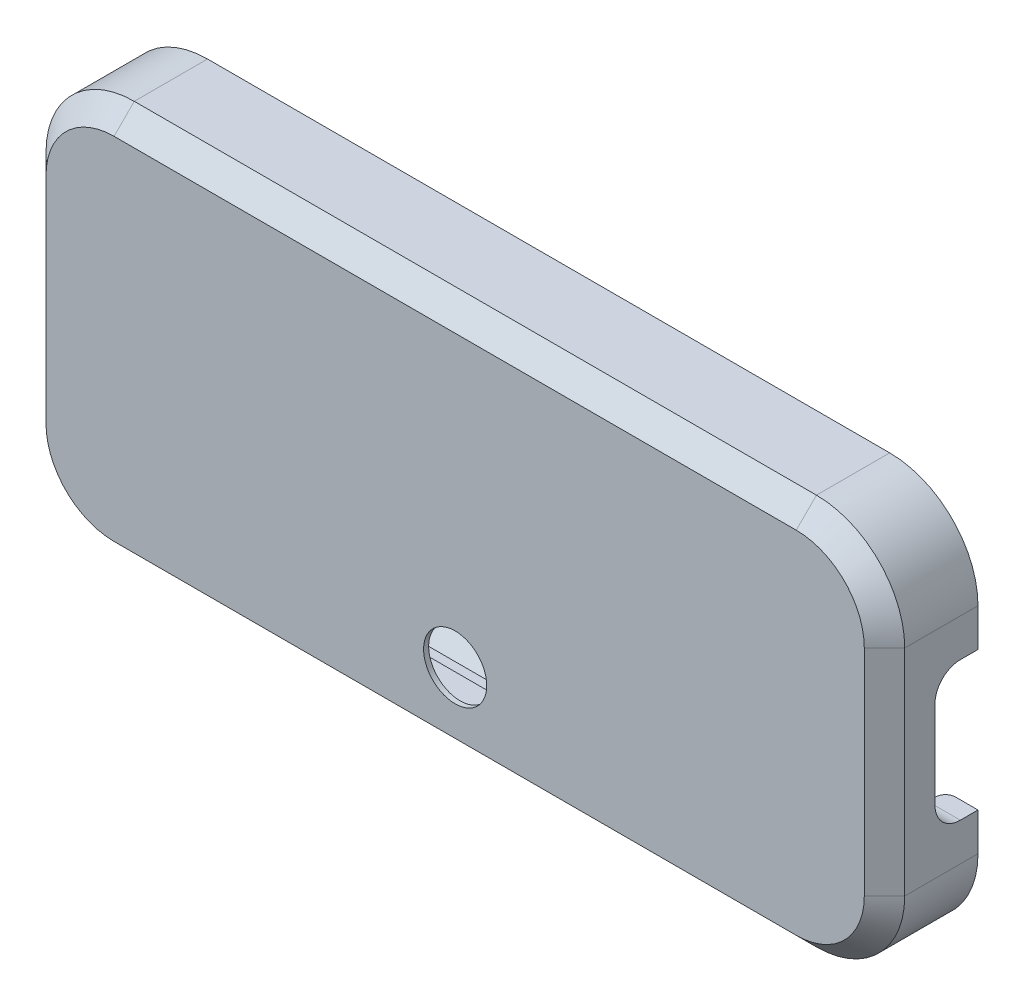
from build123d import *

# Parameters (mm, degrees)
SKIZZE1_W                         = 7.626009652
SKIZZE1_H                         = 10.039014478
AUFSATZ_LINEAR_AUSTRAGEN1_DEPTH   = 1.5
AUFSATZ_LINEAR_AUSTRAGEN1_2_DEPTH = 1.5
AUFSATZ_LINEAR_AUSTRAGEN1_3_DEPTH = 1.5
AUFSATZ_LINEAR_AUSTRAGEN1_4_DEPTH = 1.5
AUFSATZ_LINEAR_AUSTRAGEN1_5_DEPTH = 1.5
SKIZZE2_R                         = 2.5
AUFSATZ_LINEAR_AUSTRAGEN2_DEPTH   = 0.4
AUFSATZ_LINEAR_AUSTRAGEN3_DEPTH   = 2.2
AUFSATZ_LINEAR_AUSTRAGEN14_DEPTH  = 7
SKIZZE14_R                        = 2.5
SKIZZE14_W                        = 7.626009652
SKIZZE14_H                        = 10.039014478
AUFSATZ_LINEAR_AUSTRAGEN15_DEPTH  = 0.9
VERRUNDUNG1_R                     = 0.8
SCHNITT_LINEAR_AUSTRAGEN1_DEPTH   = 5
SCHNITT_LINEAR_AUSTRAGEN2_DEPTH   = 0.9
FASE1_SIZE                        = 1.6


with BuildPart() as part:
    # Skizze1 → Aufsatz-Linear austragen1 (new body)
    with BuildSketch(Plane.XY.offset(2.3000508)):
        with Locations((-8.282016764, -0.163000133)):
            Rectangle(SKIZZE1_W, SKIZZE1_H)
        Polygon((-11.69502159, 4.456507106), (-5.069011938, 4.456507106), (-5.069011938, -4.582507372), (-9.09502159, -4.582507372), (-11.69502159, -4.124057223), (-11.69502159, 0.203832093), (-9.09502159, 0.900499994), (-7.35501651, 0.900499994), (-7.35501651, -0.899500006), (-9.89502159, -0.899500006), (-9.89502159, -2.782507372), (-6.869011938, -2.782507372), (-6.869011938, 2.656507106), (-11.69502159, 2.656507106), align=None, mode=Mode.SUBTRACT)
    extrude(amount=AUFSATZ_LINEAR_AUSTRAGEN1_DEPTH)



with BuildPart() as body_2:
    # Skizze1 → Aufsatz-Linear austragen1 2 (new body)
    with BuildSketch(Plane.XY.offset(2.3000508)):
        Polygon((-15.915075673, 4.956507106), (-28.451054102, 4.956507106), (-28.451054102, -5.082507372), (-25.651054102, -5.082507372), (-25.651054102, 2.156507106), (-22.99004318, 2.156507106), (-22.99004318, -5.082507372), (-20.19004318, -5.082507372), (-20.19004318, 2.156507106), (-17.91003302, 2.156507106), (-17.91003302, -5.082507372), (-15.11003302, -5.082507372), (-15.11003302, 2.744670596), align=None)
        Polygon((-27.951054102, -4.582507372), (-26.151054102, -4.582507372), (-26.151054102, 2.656507106), (-22.49004318, 2.656507106), (-22.49004318, -4.582507372), (-20.69004318, -4.582507372), (-20.69004318, 2.656507106), (-17.41003302, 2.656507106), (-17.41003302, -4.582507372), (-15.61003302, -4.582507372), (-15.61003302, 2.656507106), (-16.265179442, 4.456507106), (-27.951054102, 4.456507106), align=None, mode=Mode.SUBTRACT)
    extrude(amount=AUFSATZ_LINEAR_AUSTRAGEN1_2_DEPTH)


with BuildPart() as body_3:
    # Skizze1 → Aufsatz-Linear austragen1 3 (new body)
    with BuildSketch(Plane.XY.offset(2.3000508)):
        Polygon((5.972009144, 4.956507106), (3.559004318, 4.956507106), (3.559004318, 8.89351498), (0.759004318, 8.89351498), (0.759004318, 4.956507106), (-1.654000508, 4.956507106), (-1.654000508, 2.156507106), (0.759004318, 2.156507106), (0.759004318, -5.082507372), (5.972009144, -5.082507372), (5.972009144, -2.282507372), (3.559004318, -2.282507372), (3.559004318, 2.156507106), (5.972009144, 2.156507106), align=None)
        Polygon((1.259004318, 8.39351498), (1.259004318, 4.456507106), (-1.154000508, 4.456507106), (-1.154000508, 2.656507106), (1.259004318, 2.656507106), (1.259004318, -4.582507372), (5.472009144, -4.582507372), (5.472009144, -2.782507372), (3.059004318, -2.782507372), (3.059004318, 2.656507106), (5.472009144, 2.656507106), (5.472009144, 4.456507106), (3.059004318, 4.456507106), (3.059004318, 8.39351498), align=None, mode=Mode.SUBTRACT)
    extrude(amount=AUFSATZ_LINEAR_AUSTRAGEN1_3_DEPTH)


with BuildPart() as body_4:
    # Skizze1 → Aufsatz-Linear austragen1 4 (new body)
    with BuildSketch(Plane.XY.offset(2.3000508)):
        Polygon((10.972977453, 4.956507106), (16.513030226, 4.956507106), (16.513030226, 2.156507106), (12.264129895, 2.156507106), (11.687020574, 1.579397784), (11.687020574, -1.705398051), (12.264129895, -2.282507372), (16.513030226, -2.282507372), (16.513030226, -5.082507372), (10.972977453, -5.082507372), (8.887020574, -3.332181725), (8.887020574, 3.206181458), align=None)
        Polygon((16.013030226, 2.656507106), (12.057023114, 2.656507106), (11.187020574, 1.786504566), (11.187020574, -1.912504832), (12.057023114, -2.782507372), (16.013030226, -2.782507372), (16.013030226, -4.582507372), (11.15496257, -4.582507372), (9.387020574, -3.099027896), (9.387020574, 2.973027629), (11.15496257, 4.456507106), (16.013030226, 4.456507106), align=None, mode=Mode.SUBTRACT)
    extrude(amount=AUFSATZ_LINEAR_AUSTRAGEN1_4_DEPTH)


with BuildPart() as body_5:
    # Skizze1 → Aufsatz-Linear austragen1 5 (new body)
    with BuildSketch(Plane.XY.offset(2.3000508)):
        Polygon((27.321990188, 4.856507106), (22.128041656, 4.856507106), (22.128041656, 8.666514726), (19.528041656, 8.666514726), (19.528041656, -4.982507372), (22.128041656, -4.982507372), (22.128041656, 2.256507106), (25.497053594, 2.256507106), (25.497053594, -4.982507372), (28.097053594, -4.982507372), (28.097053594, 2.727037898), align=None)
        Polygon((19.928041656, 8.266514726), (19.928041656, -4.582507372), (21.728041656, -4.582507372), (21.728041656, 2.656507106), (25.897053594, 2.656507106), (25.897053594, -4.582507372), (27.697053594, -4.582507372), (27.697053594, 2.656507106), (27.041907172, 4.456507106), (21.728041656, 4.456507106), (21.728041656, 8.266514726), align=None, mode=Mode.SUBTRACT)
    extrude(amount=AUFSATZ_LINEAR_AUSTRAGEN1_5_DEPTH)


with BuildPart() as part_1:
    add(part.part)

    add(body_2.part)  # Aufsatz-Linear austragen2 merges body 2

    add(body_3.part)  # Aufsatz-Linear austragen2 merges body 3

    add(body_4.part)  # Aufsatz-Linear austragen2 merges body 4

    add(body_5.part)  # Aufsatz-Linear austragen2 merges body 5
    # Skizze2 → Aufsatz-Linear austragen2 (add)
    with BuildSketch(Plane.XY.offset(3.8000508)):
        with BuildLine():
            Line((-27.00005334, 15.487325375), (27.00005588, 15.487325375))
            ThreePointArc((27.00005588, 15.487325375), (31.940828463, 13.440790362), (33.987363475, 8.50001778))
            Line((33.987363475, 8.50001778), (33.987363475, -8.50001778))
            ThreePointArc((33.987363475, -8.50001778), (31.940828463, -13.440790362), (27.00005588, -15.487325375))
            Line((27.00005588, -15.487325375), (-27.00005334, -15.487325375))
            ThreePointArc((-27.00005334, -15.487325375), (-31.940825922, -13.440790362), (-33.987360935, -8.50001778))
            Line((-33.987360935, -8.50001778), (-33.987360935, 8.50001778))
            ThreePointArc((-33.987360935, 8.50001778), (-31.940825922, 13.440790362), (-27.00005334, 15.487325375))
        make_face()
        with Locations((0, -9.017018034)):
            Circle(SKIZZE2_R, mode=Mode.SUBTRACT)
    extrude(amount=AUFSATZ_LINEAR_AUSTRAGEN2_DEPTH)

    # Skizze3 → Aufsatz-Linear austragen3 (add)
    with BuildSketch(Plane(origin=(0, 0, 3.8000508), x_dir=(-1, 0, 0), z_dir=(0, 0, -1))):
        with BuildLine():
            Line((-27.225, -12.725), (27.225, -12.725))
            ThreePointArc((27.225, -12.725), (30.053427125, -11.553427125), (31.225, -8.725))
            Line((31.225, -8.725), (31.225, 8.725))
            ThreePointArc((31.225, 8.725), (30.053427125, 11.553427125), (27.225, 12.725))
            Line((27.225, 12.725), (-27.225, 12.725))
            ThreePointArc((-27.225, 12.725), (-30.053427125, 11.553427125), (-31.225, 8.725))
            Line((-31.225, 8.725), (-31.225, -8.725))
            ThreePointArc((-31.225, -8.725), (-30.053427125, -11.553427125), (-27.225, -12.725))
        make_face()
        with BuildLine():
            Line((-27.225, 11.925), (27.225, 11.925))
            ThreePointArc((27.225, 11.925), (29.4877417, 10.9877417), (30.425, 8.725))
            Line((30.425, 8.725), (30.425, -8.725))
            ThreePointArc((30.425, -8.725), (29.4877417, -10.9877417), (27.225, -11.925))
            Line((27.225, -11.925), (-27.225, -11.925))
            ThreePointArc((-27.225, -11.925), (-29.4877417, -10.9877417), (-30.425, -8.725))
            Line((-30.425, -8.725), (-30.425, 8.725))
            ThreePointArc((-30.425, 8.725), (-29.4877417, 10.9877417), (-27.225, 11.925))
        make_face(mode=Mode.SUBTRACT)
    extrude(amount=AUFSATZ_LINEAR_AUSTRAGEN3_DEPTH)

    # Skizze10 → Aufsatz-Linear austragen14 (add)
    with BuildSketch(Plane(origin=(0, 0, 3.8000508), x_dir=(-1, 0, 0), z_dir=(0, 0, -1))):
        with BuildLine():
            Line((27.00005334, 15.487325375), (-27.00005588, 15.487325375))
            ThreePointArc((-27.00005588, 15.487325375), (-31.940828463, 13.440790362), (-33.987363475, 8.50001778))
            Line((-33.987363475, 8.50001778), (-33.987363475, -8.50001778))
            ThreePointArc((-33.987363475, -8.50001778), (-31.940828463, -13.440790362), (-27.00005588, -15.487325375))
            Line((-27.00005588, -15.487325375), (27.00005334, -15.487325375))
            ThreePointArc((27.00005334, -15.487325375), (31.940825922, -13.440790362), (33.987360935, -8.50001778))
            Line((33.987360935, -8.50001778), (33.987360935, 8.50001778))
            ThreePointArc((33.987360935, 8.50001778), (31.940825922, 13.440790362), (27.00005334, 15.487325375))
        make_face()
        with BuildLine():
            Line((31.225, -8.725), (31.225, 8.725))
            ThreePointArc((31.225, 8.725), (30.053427125, 11.553427125), (27.225, 12.725))
            Line((27.225, 12.725), (-27.225, 12.725))
            ThreePointArc((-27.225, 12.725), (-30.053427125, 11.553427125), (-31.225, 8.725))
            Line((-31.225, 8.725), (-31.225, -8.725))
            ThreePointArc((-31.225, -8.725), (-30.053427125, -11.553427125), (-27.225, -12.725))
            Line((-27.225, -12.725), (27.225, -12.725))
            ThreePointArc((27.225, -12.725), (30.053427125, -11.553427125), (31.225, -8.725))
        make_face(mode=Mode.SUBTRACT)
    extrude(amount=AUFSATZ_LINEAR_AUSTRAGEN14_DEPTH)

    # Skizze14 → Aufsatz-Linear austragen15 (add)
    with BuildSketch(Plane(origin=(0, 0, 3.8000508), x_dir=(-1, 0, 0), z_dir=(0, 0, -1))):
        with BuildLine():
            Line((27.225, 11.925), (-27.225, 11.925))
            ThreePointArc((-27.225, 11.925), (-29.4877417, 10.9877417), (-30.425, 8.725))
            Line((-30.425, 8.725), (-30.425, -8.725))
            ThreePointArc((-30.425, -8.725), (-29.4877417, -10.9877417), (-27.225, -11.925))
            Line((-27.225, -11.925), (27.225, -11.925))
            ThreePointArc((27.225, -11.925), (29.4877417, -10.9877417), (30.425, -8.725))
            Line((30.425, -8.725), (30.425, 8.725))
            ThreePointArc((30.425, 8.725), (29.4877417, 10.9877417), (27.225, 11.925))
        make_face()
        with Locations((0, -9.017018034)):
            Circle(SKIZZE14_R, mode=Mode.SUBTRACT)
        with Locations((8.282016764, -0.163000133)):
            Rectangle(SKIZZE14_W, SKIZZE14_H, mode=Mode.SUBTRACT)
        Polygon((15.915075673, 4.956507106), (15.11003302, 2.744670596), (15.11003302, -5.082507372), (17.91003302, -5.082507372), (17.91003302, 2.156507106), (20.19004318, 2.156507106), (20.19004318, -5.082507372), (22.99004318, -5.082507372), (22.99004318, 2.156507106), (25.651054102, 2.156507106), (25.651054102, -5.082507372), (28.451054102, -5.082507372), (28.451054102, 4.956507106), align=None, mode=Mode.SUBTRACT)
        Polygon((-5.972009144, 4.956507106), (-5.972009144, 2.156507106), (-3.559004318, 2.156507106), (-3.559004318, -2.282507372), (-5.972009144, -2.282507372), (-5.972009144, -5.082507372), (-0.759004318, -5.082507372), (-0.759004318, 2.156507106), (1.654000508, 2.156507106), (1.654000508, 4.956507106), (-0.759004318, 4.956507106), (-0.759004318, 8.89351498), (-3.559004318, 8.89351498), (-3.559004318, 4.956507106), align=None, mode=Mode.SUBTRACT)
        Polygon((-8.887020574, 3.206181458), (-10.972977453, 4.956507106), (-16.513030226, 4.956507106), (-16.513030226, 2.156507106), (-12.264129895, 2.156507106), (-11.687020574, 1.579397784), (-11.687020574, -1.705398051), (-12.264129895, -2.282507372), (-16.513030226, -2.282507372), (-16.513030226, -5.082507372), (-10.972977453, -5.082507372), (-8.887020574, -3.332181725), align=None, mode=Mode.SUBTRACT)
        Polygon((-27.321990188, 4.856507106), (-28.097053594, 2.727037898), (-28.097053594, -4.982507372), (-25.497053594, -4.982507372), (-25.497053594, 2.256507106), (-22.128041656, 2.256507106), (-22.128041656, -4.982507372), (-19.528041656, -4.982507372), (-19.528041656, 8.666514726), (-22.128041656, 8.666514726), (-22.128041656, 4.856507106), align=None, mode=Mode.SUBTRACT)
    extrude(amount=AUFSATZ_LINEAR_AUSTRAGEN15_DEPTH)

    # Schnitt-Austragung1: sweep along a path in Skizze12
    with BuildLine(Plane(origin=(0, 0, -3.1999492), x_dir=(-1, 0, 0), z_dir=(0, 0, -1))) as schnitt_austragung1_path:
        Line((31.225, -8.725), (31.225, 8.725))
        ThreePointArc((31.225, 8.725), (30.053427125, 11.553427125), (27.225, 12.725))
        Line((27.225, 12.725), (-27.225, 12.725))
        ThreePointArc((-27.225, 12.725), (-30.053427125, 11.553427125), (-31.225, 8.725))
        Line((-31.225, 8.725), (-31.225, -8.725))
        ThreePointArc((-31.225, -8.725), (-30.053427125, -11.553427125), (-27.225, -12.725))
        Line((-27.225, -12.725), (27.225, -12.725))
        ThreePointArc((27.225, -12.725), (30.053427125, -11.553427125), (31.225, -8.725))
    # Skizze11 → Schnitt-Austragung1 (sweep, cut)
    with BuildSketch(Plane(origin=(0, 0, 0), x_dir=(0, 0, -1), z_dir=(1, 0, 0))):
        Polygon((3.1999492, 12.725), (-0.1000508, 12.725), (-0.1000508, 13.426436654), align=None)
    sweep(path=schnitt_austragung1_path.line, mode=Mode.SUBTRACT)

    # Verrundung1
    verrundung1_edges = [part_1.edges().sort_by_distance(p)[0] for p in [
        (0, 12.725, -3.1999492),
        (30.053427125, 11.553427125, -3.1999492),
        (31.225, 0, -3.1999492),
        (30.053427125, -11.553427125, -3.1999492),
        (-31.225, 0, -3.1999492),
        (0, -12.725, -3.1999492),
        (-30.053427125, -11.553427125, -3.1999492),
        (-30.053427125, 11.553427125, -3.1999492),
        (0, 12.725, -3.1999492),
    ]]
    fillet(verrundung1_edges, radius=VERRUNDUNG1_R)

    # Skizze13 → Schnitt-Linear austragen1 (cut)
    with BuildSketch(Plane(origin=(33.987363475, 0, 0), x_dir=(0, 0, -1), z_dir=(1, 0, 0))):
        with BuildLine():
            Line((1.7999492, -5.5), (3.9999492, -5.5))
            ThreePointArc((3.9999492, -5.5), (5.414162762, -4.914213562), (5.9999492, -3.5))
            Line((5.9999492, -3.5), (5.9999492, 3.5))
            ThreePointArc((5.9999492, 3.5), (5.414162762, 4.914213562), (3.9999492, 5.5))
            Line((3.9999492, 5.5), (1.7999492, 5.5))
            ThreePointArc((1.7999492, 5.5), (0.385735638, 4.914213562), (-0.2000508, 3.5))
            Line((-0.2000508, 3.5), (-0.2000508, -3.5))
            ThreePointArc((-0.2000508, -3.5), (0.385735638, -4.914213562), (1.7999492, -5.5))
        make_face()
    extrude(amount=-SCHNITT_LINEAR_AUSTRAGEN1_DEPTH, mode=Mode.SUBTRACT)

    # Skizze15 → Schnitt-Linear austragen2 (cut)
    with BuildSketch(Plane(origin=(0, 0, 2.9000508), x_dir=(-1, 0, 0), z_dir=(0, 0, -1))):
        with BuildLine():
            Line((-5, -6.109036068), (5, -6.109036068))
            ThreePointArc((5, -6.109036068), (7.907981966, -9.017018034), (5, -11.925))
            Line((5, -11.925), (-5, -11.925))
            ThreePointArc((-5, -11.925), (-7.907981966, -9.017018034), (-5, -6.109036068))
        make_face()
    extrude(amount=-SCHNITT_LINEAR_AUSTRAGEN2_DEPTH, mode=Mode.SUBTRACT)

    # Fase1
    fase1_edges = [part_1.edges().sort_by_distance(p)[0] for p in [
        (-31.940825922, 13.440790362, 4.2000508),
        (-33.987360935, 0, 4.2000508),
        (-31.940825922, -13.440790362, 4.2000508),
        (1.27e-06, -15.487325375, 4.2000508),
        (31.940828463, -13.440790362, 4.2000508),
        (33.987363475, 0, 4.2000508),
        (31.940828463, 13.440790362, 4.2000508),
        (1.27e-06, 15.487325375, 4.2000508),
    ]]
    chamfer(fase1_edges, length=FASE1_SIZE)


solid = part_1.part
